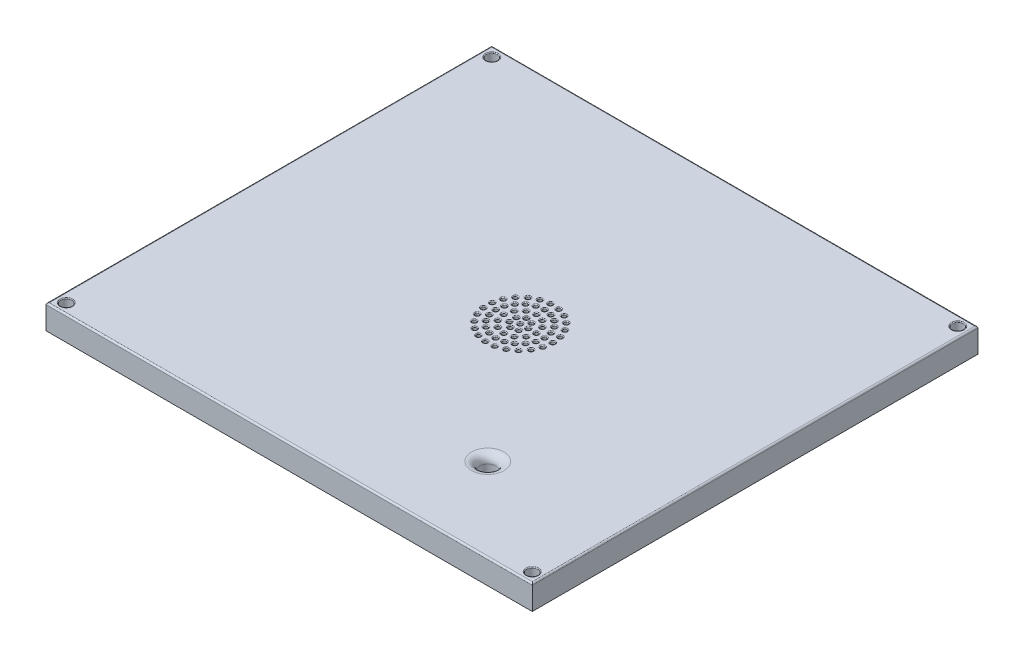
from build123d import *

# Parameters (mm, degrees)
SKETCH1_W           = 152.4
SKETCH1_H           = 139.7
BOSS_EXTRUDE1_DEPTH = 7.62
SKETCH2_R           = 1.7526
CUT_EXTRUDE1_DEPTH  = 104.650986006
SKETCH3_R           = 2.54
CUT_EXTRUDE2_DEPTH  = 104.650986006
FILLET1_R           = 2.54
FILLET2_R           = 2.54
FILLET3_R           = 0.508
SKETCH4_R           = 0.635
CUT_EXTRUDE3_DEPTH  = 104.650986006
FILLET4_R           = 0.254


with BuildPart() as part:
    # Sketch1 → Boss-Extrude1 (new body)
    with BuildSketch(Plane(origin=(0, 0, 0), x_dir=(1, 0, 0), z_dir=(0, 1, 0))):
        Rectangle(SKETCH1_W, SKETCH1_H)
    extrude(amount=BOSS_EXTRUDE1_DEPTH)

    # Sketch2 → Cut-Extrude1 (cut, through all)
    with BuildSketch(Plane(origin=(0, 7.62, 0), x_dir=(1, 0, 0), z_dir=(0, 1, 0))):
        with Locations(Location((-73.025, 66.675, 0), (0, 0, 270))):
            Circle(SKETCH2_R)
        with Locations(Location((73.025, 66.675, 0), (0, 0, 270))):
            Circle(SKETCH2_R)
        with Locations(Location((73.025, -66.675, 0), (0, 0, 270))):
            Circle(SKETCH2_R)
        with Locations(Location((-73.025, -66.675, 0), (0, 0, 270))):
            Circle(SKETCH2_R)
    extrude(amount=-CUT_EXTRUDE1_DEPTH, mode=Mode.SUBTRACT)

    # Sketch3 → Cut-Extrude2 (cut, through all)
    with BuildSketch(Plane(origin=(0, 7.62, 0), x_dir=(1, 0, 0), z_dir=(0, 1, 0))):
        with Locations(Location((36.068, -43.6626, 0), (0, 0, 270))):
            Circle(SKETCH3_R)
    extrude(amount=-CUT_EXTRUDE2_DEPTH, mode=Mode.SUBTRACT)

    # Fillet1
    fillet1_edges = [part.edges().sort_by_distance(p)[0] for p in [
        (36.068, 7.62, 41.1226),
    ]]
    fillet(fillet1_edges, radius=FILLET1_R)

    # Fillet2
    fillet2_edges = [part.edges().sort_by_distance(p)[0] for p in [
        (36.068, 0, 41.1226),
    ]]
    fillet(fillet2_edges, radius=FILLET2_R)

    # Fillet3
    fillet3_edges = [part.edges().sort_by_distance(p)[0] for p in [
        (-76.2, 7.62, 0),
        (0, 7.62, 69.85),
        (76.2, 7.62, 0),
        (0, 7.62, -69.85),
    ]]
    fillet(fillet3_edges, radius=FILLET3_R)

    # Sketch4 → Cut-Extrude3 (cut, through all)
    with BuildSketch(Plane(origin=(0, 7.62, 0), x_dir=(1, 0, 0), z_dir=(0, 1, 0))):
        with Locations(Location((3.81, -1.27, 0), (0, 0, 270))):
            Circle(SKETCH4_R)
        with Locations(Location((6.365789878, -1.27, 0), (0, 0, 270))):
            Circle(SKETCH4_R)
        with Locations(Location((8.921579757, -1.27, 0), (0, 0, 270))):
            Circle(SKETCH4_R)
        with Locations(Location((11.477369635, -1.27, 0), (0, 0, 270))):
            Circle(SKETCH4_R)
        with Locations(Location((14.033159514, -1.27, 0), (0, 0, 270))):
            Circle(SKETCH4_R)
        with Locations(Location((5.403508925, -3.26819699, 0), (0, 0, 270))):
            Circle(SKETCH4_R)
        with Locations(Location((3.241283249, -3.76171089, 0), (0, 0, 270))):
            Circle(SKETCH4_R)
        with Locations(Location((1.507312887, -2.378915669, 0), (0, 0, 270))):
            Circle(SKETCH4_R)
        with Locations(Location((1.507312887, -0.161084331, 0), (0, 0, 270))):
            Circle(SKETCH4_R)
        with Locations(Location((3.241283249, 1.22171089, 0), (0, 0, 270))):
            Circle(SKETCH4_R)
        with Locations(Location((5.403508925, 0.72819699, 0), (0, 0, 270))):
            Circle(SKETCH4_R)
        with Locations(Location((8.236757923, -3.825789878, 0), (0, 0, 270))):
            Circle(SKETCH4_R)
        with Locations(Location((6.365789878, -5.696757923, 0), (0, 0, 270))):
            Circle(SKETCH4_R)
        with Locations(Location((3.81, -6.381579757, 0), (0, 0, 270))):
            Circle(SKETCH4_R)
        with Locations(Location((1.254210122, -5.696757923, 0), (0, 0, 270))):
            Circle(SKETCH4_R)
        with Locations(Location((-0.616757923, -3.825789878, 0), (0, 0, 270))):
            Circle(SKETCH4_R)
        with Locations(Location((-1.301579757, -1.27, 0), (0, 0, 270))):
            Circle(SKETCH4_R)
        with Locations(Location((-0.616757923, 1.285789878, 0), (0, 0, 270))):
            Circle(SKETCH4_R)
        with Locations(Location((1.254210122, 3.156757923, 0), (0, 0, 270))):
            Circle(SKETCH4_R)
        with Locations(Location((3.81, 3.841579757, 0), (0, 0, 270))):
            Circle(SKETCH4_R)
        with Locations(Location((6.365789878, 3.156757923, 0), (0, 0, 270))):
            Circle(SKETCH4_R)
        with Locations(Location((8.236757923, 1.285789878, 0), (0, 0, 270))):
            Circle(SKETCH4_R)
        with Locations(Location((11.102101855, -3.639347519, 0), (0, 0, 270))):
            Circle(SKETCH4_R)
        with Locations(Location((10.013032337, -5.776766796, 0), (0, 0, 270))):
            Circle(SKETCH4_R)
        with Locations(Location((8.316766796, -7.473032337, 0), (0, 0, 270))):
            Circle(SKETCH4_R)
        with Locations(Location((6.179347519, -8.562101855, 0), (0, 0, 270))):
            Circle(SKETCH4_R)
        with Locations(Location((3.81, -8.937369635, 0), (0, 0, 270))):
            Circle(SKETCH4_R)
        with Locations(Location((1.440652481, -8.562101855, 0), (0, 0, 270))):
            Circle(SKETCH4_R)
        with Locations(Location((-0.696766796, -7.473032337, 0), (0, 0, 270))):
            Circle(SKETCH4_R)
        with Locations(Location((-2.393032337, -5.776766796, 0), (0, 0, 270))):
            Circle(SKETCH4_R)
        with Locations(Location((-3.482101855, -3.639347519, 0), (0, 0, 270))):
            Circle(SKETCH4_R)
        with Locations(Location((-3.857369635, -1.27, 0), (0, 0, 270))):
            Circle(SKETCH4_R)
        with Locations(Location((-3.482101855, 1.099347519, 0), (0, 0, 270))):
            Circle(SKETCH4_R)
        with Locations(Location((-2.393032337, 3.236766796, 0), (0, 0, 270))):
            Circle(SKETCH4_R)
        with Locations(Location((-0.696766796, 4.933032337, 0), (0, 0, 270))):
            Circle(SKETCH4_R)
        with Locations(Location((1.440652481, 6.022101855, 0), (0, 0, 270))):
            Circle(SKETCH4_R)
        with Locations(Location((3.81, 6.397369635, 0), (0, 0, 270))):
            Circle(SKETCH4_R)
        with Locations(Location((6.179347519, 6.022101855, 0), (0, 0, 270))):
            Circle(SKETCH4_R)
        with Locations(Location((8.316766796, 4.933032337, 0), (0, 0, 270))):
            Circle(SKETCH4_R)
        with Locations(Location((10.013032337, 3.236766796, 0), (0, 0, 270))):
            Circle(SKETCH4_R)
        with Locations(Location((11.102101855, 1.099347519, 0), (0, 0, 270))):
            Circle(SKETCH4_R)
        with Locations(Location((13.654057027, -4.028175428, 0), (0, 0, 270))):
            Circle(SKETCH4_R)
        with Locations(Location((12.544865864, -6.581789602, 0), (0, 0, 270))):
            Circle(SKETCH4_R)
        with Locations(Location((10.78784966, -8.741452641, 0), (0, 0, 270))):
            Circle(SKETCH4_R)
        with Locations(Location((8.513318267, -10.346992218, 0), (0, 0, 270))):
            Circle(SKETCH4_R)
        with Locations(Location((5.889963275, -11.279332806, 0), (0, 0, 270))):
            Circle(SKETCH4_R)
        with Locations(Location((3.112346923, -11.469326969, 0), (0, 0, 270))):
            Circle(SKETCH4_R)
        with Locations(Location((0.386472307, -10.90288371, 0), (0, 0, 270))):
            Circle(SKETCH4_R)
        with Locations(Location((-2.085494921, -9.622013534, 0), (0, 0, 270))):
            Circle(SKETCH4_R)
        with Locations(Location((-4.120220262, -7.721712722, 0), (0, 0, 270))):
            Circle(SKETCH4_R)
        with Locations(Location((-5.566797443, -5.342917892, 0), (0, 0, 270))):
            Circle(SKETCH4_R)
        with Locations(Location((-6.317940454, -2.662053374, 0), (0, 0, 270))):
            Circle(SKETCH4_R)
        with Locations(Location((-6.317940454, 0.122053374, 0), (0, 0, 270))):
            Circle(SKETCH4_R)
        with Locations(Location((-5.566797443, 2.802917892, 0), (0, 0, 270))):
            Circle(SKETCH4_R)
        with Locations(Location((-4.120220262, 5.181712722, 0), (0, 0, 270))):
            Circle(SKETCH4_R)
        with Locations(Location((-2.085494921, 7.082013534, 0), (0, 0, 270))):
            Circle(SKETCH4_R)
        with Locations(Location((0.386472307, 8.36288371, 0), (0, 0, 270))):
            Circle(SKETCH4_R)
        with Locations(Location((3.112346923, 8.929326969, 0), (0, 0, 270))):
            Circle(SKETCH4_R)
        with Locations(Location((5.889963275, 8.739332806, 0), (0, 0, 270))):
            Circle(SKETCH4_R)
        with Locations(Location((8.513318267, 7.806992218, 0), (0, 0, 270))):
            Circle(SKETCH4_R)
        with Locations(Location((10.78784966, 6.201452641, 0), (0, 0, 270))):
            Circle(SKETCH4_R)
        with Locations(Location((12.544865864, 4.041789602, 0), (0, 0, 270))):
            Circle(SKETCH4_R)
        with Locations(Location((13.654057027, 1.488175428, 0), (0, 0, 270))):
            Circle(SKETCH4_R)
    extrude(amount=-CUT_EXTRUDE3_DEPTH, mode=Mode.SUBTRACT)

    # Fillet4
    fillet4_edges = [part.edges().sort_by_distance(p)[0] for p in [
        (11.477369635, 7.62, 0.635),
        (14.033159514, 7.62, 0.635),
        (6.365789878, 7.62, 0.635),
        (8.921579757, 7.62, 0.635),
        (1.507312887, 7.62, 1.743915669),
        (1.507312887, 7.62, -0.473915669),
        (5.403508925, 7.62, 2.63319699),
        (3.241283249, 7.62, 3.12671089),
        (8.236757923, 7.62, 3.190789878),
        (6.365789878, 7.62, 5.061757923),
        (3.241283249, 7.62, -1.85671089),
        (5.403508925, 7.62, -1.36319699),
        (-0.616757923, 7.62, 3.190789878),
        (-1.301579757, 7.62, 0.635),
        (3.81, 7.62, 5.746579757),
        (1.254210122, 7.62, 5.061757923),
        (11.102101855, 7.62, 3.004347519),
        (8.236757923, 7.62, -1.920789878),
        (8.316766796, 7.62, 6.838032337),
        (10.013032337, 7.62, 5.141766796),
        (1.254210122, 7.62, -3.791757923),
        (-0.616757923, 7.62, -1.920789878),
        (6.365789878, 7.62, -3.791757923),
        (3.81, 7.62, -4.476579757),
        (-3.482101855, 7.62, 3.004347519),
        (-2.393032337, 7.62, 5.141766796),
        (-3.482101855, 7.62, -1.734347519),
        (-3.857369635, 7.62, 0.635),
        (-73.025, 7.62, 64.9224),
        (3.81, 7.62, 8.302369635),
        (6.179347519, 7.62, 7.927101855),
        (-0.696766796, 7.62, 6.838032337),
        (1.440652481, 7.62, 7.927101855),
        (5.889963275, 7.62, 10.644332806),
        (3.112346923, 7.62, 10.834326969),
        (1.440652481, 7.62, -6.657101855),
        (3.81, 7.62, -7.032369635),
        (-2.393032337, 7.62, -3.871766796),
        (-0.696766796, 7.62, -5.568032337),
        (73.025, 7.62, 64.9224),
        (10.013032337, 7.62, -3.871766796),
        (11.102101855, 7.62, -1.734347519),
        (10.78784966, 7.62, 8.106452641),
        (8.513318267, 7.62, 9.711992218),
        (13.654057027, 7.62, 3.393175428),
        (12.544865864, 7.62, 5.946789602),
        (0.386472307, 7.62, 10.26788371),
        (-2.085494921, 7.62, 8.987013534),
        (13.654057027, 7.62, -2.123175428),
        (12.544865864, 7.62, -4.676789602),
        (73.025, 7.62, -68.4276),
        (5.889963275, 7.62, -9.374332806),
        (3.112346923, 7.62, -9.564326969),
        (6.179347519, 7.62, -6.657101855),
        (8.316766796, 7.62, -5.568032337),
        (8.513318267, 7.62, -8.441992218),
        (10.78784966, 7.62, -6.836452641),
        (-6.317940454, 7.62, 2.027053374),
        (-6.317940454, 7.62, -0.757053374),
        (-4.120220262, 7.62, 7.086712722),
        (-5.566797443, 7.62, 4.707917892),
        (-73.025, 7.62, -68.4276),
        (-2.085494921, 7.62, -7.717013534),
        (0.386472307, 7.62, -8.99788371),
        (-5.566797443, 7.62, -3.437917892),
        (-4.120220262, 7.62, -5.816712722),
        (3.81, 7.62, 0.635),
    ]]
    fillet(fillet4_edges, radius=FILLET4_R)


solid = part.part
